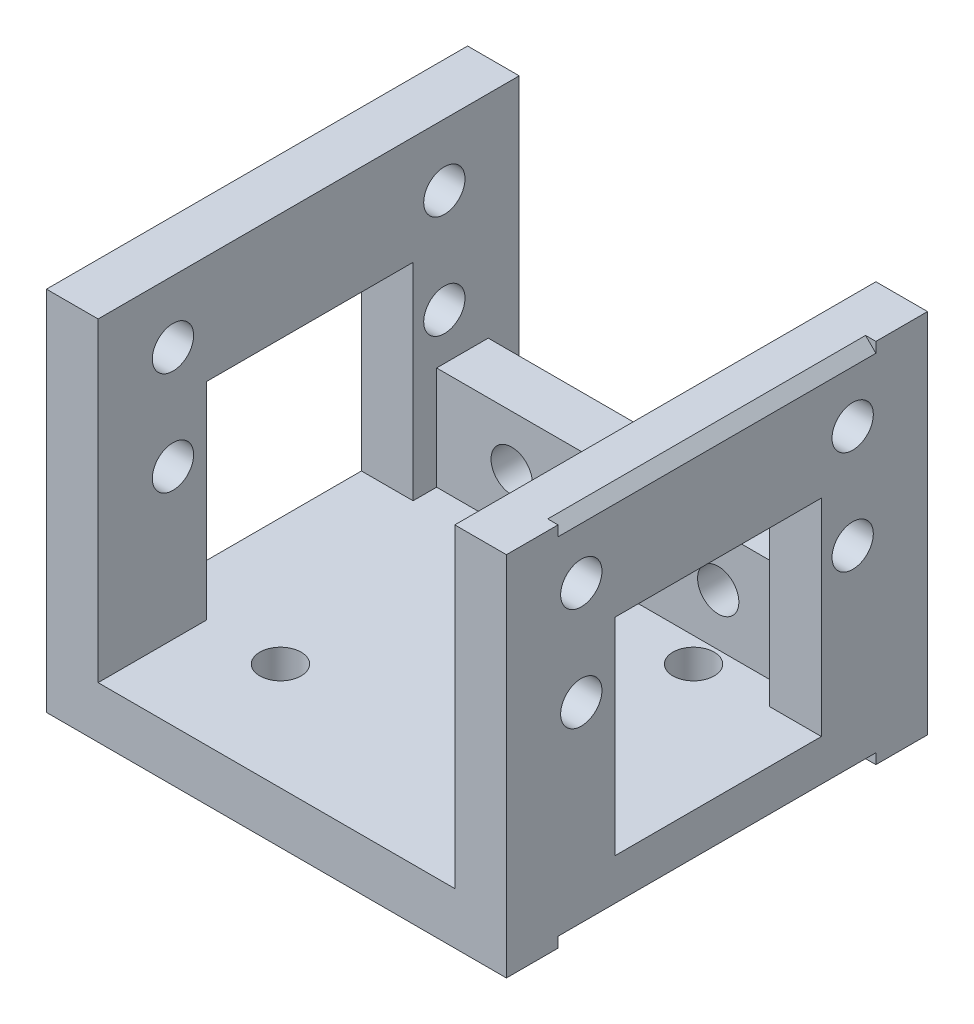
from build123d import *

# Parameters (mm, degrees)
EXTRUDE_2_DEPTH     = 34.78
CUT_EXTRUDE_1_REACH = 68.736
SKETCH_2_W          = 20
SKETCH_2_H          = 20
CHAMFER_1_SIZE      = 1
CUT_EXTRUDE_START   = -44.54
SKETCH_3_R          = 2
CUT_EXTRUDE_2_DEPTH = 44.54
SKETCH_4_R          = 2
CUT_EXTRUDE_3_DEPTH = 5
SKETCH_6_W          = 34.54
SKETCH_6_H          = 5
EXTRUDE_3_DEPTH     = 10
SKETCH_8_R          = 2
CUT_EXTRUDE_4_DEPTH = 5
EXTRUDE_START       = -2
EXTRUDE_4_DEPTH     = 5


with BuildPart() as part:
    # 草图1 → 凸台-拉伸2 (new body)
    with BuildSketch(Plane.XY):
        Polygon((0, 0), (0, 35.5), (5, 35.5), (5, 5), (39.54, 5), (39.54, 35.5), (44.54, 35.5), (44.54, 0), align=None)
    extrude(amount=EXTRUDE_2_DEPTH)

    # 切除-拉伸1: up to this face of the body (flat: up to its plane)
    cut_extrude_1_end = Plane(part.part.faces().sort_by_distance((0, 17.75, 17.39))[0])
    # 草图2 → 切除-拉伸1 (cut, up to the picked face)
    with BuildSketch(Plane(origin=(44.54, 0, 0), x_dir=(0, 0, -1), z_dir=(1, 0, 0)), mode=Mode.PRIVATE) as cut_extrude_1_sk1:
        with Locations((-17.28, 15)):
            Rectangle(SKETCH_2_W, SKETCH_2_H)
    cut_extrude_1_tool1 = split(extrude(cut_extrude_1_sk1.sketch, amount=-CUT_EXTRUDE_1_REACH, mode=Mode.PRIVATE), bisect_by=cut_extrude_1_end, keep=Keep.BOTH, mode=Mode.PRIVATE)
    add(cut_extrude_1_tool1.solids().sort_by(Axis((44.54, 15, 17.28), (-1, 0, 0)))[0], mode=Mode.SUBTRACT)

    # 倒角1
    chamfer_1_edges = [part.edges().sort_by_distance(p)[0] for p in [
        (44.54, 17.75, 0),
        (22.27, 0, 0),
        (0, 0, 17.39),
        (44.54, 35.5, 17.39),
        (44.54, 0, 17.39),
        (0, 17.75, 34.78),
        (22.27, 0, 34.78),
        (0, 17.75, 0),
        (44.54, 17.75, 34.78),
    ]]
    chamfer(chamfer_1_edges, length=CHAMFER_1_SIZE)

    # 草图3 → 切除-拉伸2 (cut)
    with BuildSketch(Plane(origin=(44.54, 0, 0), x_dir=(0, 0, -1), z_dir=(1, 0, 0)).offset(CUT_EXTRUDE_START)):
        with Locations((-30.53, 19.5)):
            Circle(SKETCH_3_R)
        with Locations((-4.25, 19.5)):
            Circle(SKETCH_3_R)
        with Locations((-4.25, 29.5)):
            Circle(SKETCH_3_R)
        with BuildLine():
            ThreePointArc((-31.619976701, 31.176887233), (-32.53, 29.5), (-31.619976701, 27.823112767))
            Line((-31.619976701, 27.823112767), (-30.53, 29.5))
            Line((-30.53, 29.5), (-31.619976701, 31.176887233))
        make_face()
        with BuildLine():
            Line((-30.53, 29.5), (-31.619976701, 27.823112767))
            ThreePointArc((-31.619976701, 27.823112767), (-30.53, 27.5), (-29.440023299, 27.823112767))
            Line((-29.440023299, 27.823112767), (-30.53, 29.5))
        make_face()
        with BuildLine():
            Line((-30.53, 29.5), (-29.440023299, 27.823112767))
            ThreePointArc((-29.440023299, 27.823112767), (-28.772167044, 28.546048587), (-28.53, 29.5))
            ThreePointArc((-28.53, 29.5), (-28.772167044, 30.453951413), (-29.440023299, 31.176887233))
            Line((-29.440023299, 31.176887233), (-30.53, 29.5))
        make_face()
        with BuildLine():
            ThreePointArc((-29.440023299, 31.176887233), (-30.53, 31.5), (-31.619976701, 31.176887233))
            Line((-31.619976701, 31.176887233), (-30.53, 29.5))
            Line((-30.53, 29.5), (-29.440023299, 31.176887233))
        make_face()
    extrude(amount=CUT_EXTRUDE_2_DEPTH, mode=Mode.SUBTRACT)

    # 草图4 → 切除-拉伸3 (cut)
    with BuildSketch(Plane.XZ):
        with Locations(Location((12.27, 7.39, 0), (0, 0, 270))):
            Circle(SKETCH_4_R)
        with Locations(Location((12.27, 27.39, 0), (0, 0, 270))):
            Circle(SKETCH_4_R)
        with Locations(Location((32.27, 27.39, 0), (0, 0, 270))):
            Circle(SKETCH_4_R)
        with Locations(Location((32.27, 7.39, 0), (0, 0, 270))):
            Circle(SKETCH_4_R)
    extrude(amount=-CUT_EXTRUDE_3_DEPTH, mode=Mode.SUBTRACT)

    # 草图6 → 凸台-拉伸3 (add)
    with BuildSketch(Plane(origin=(0, 5, 0), x_dir=(1, 0, 0), z_dir=(0, 1, 0))):
        with Locations((22.27, -2.5)):
            Rectangle(SKETCH_6_W, SKETCH_6_H)
    extrude(amount=EXTRUDE_3_DEPTH)

    # 草图8 → 切除-拉伸4 (cut)
    with BuildSketch(Plane.XY.offset(5)):
        with Locations((12.27, 10)):
            Circle(SKETCH_8_R)
        with Locations((32.27, 10)):
            Circle(SKETCH_8_R)
    extrude(amount=-CUT_EXTRUDE_4_DEPTH, mode=Mode.SUBTRACT)

    # 草图9 → 凸台-拉伸4 (add)
    with BuildSketch(Plane.XY.offset(34.78).offset(EXTRUDE_START)):
        Polygon((44.54, 34.5), (44.54, 1), (44.54, 0), (43.54, 0), (1, 0), (0, 0), (0, 1), (0, 35.5), (1, 35.5), (5, 35.5), (5, 5), (39.54, 5), (39.54, 35.5), (44.54, 35.5), align=None)
    extrude_4 = extrude(amount=EXTRUDE_4_DEPTH)

    # 镜向1: 凸台-拉伸4 across plane
    add(extrude_4.mirror(Plane(origin=(0, 0, 17.39), x_dir=(1, 0, 0), z_dir=(0, 0, -1))))


solid = part.part
